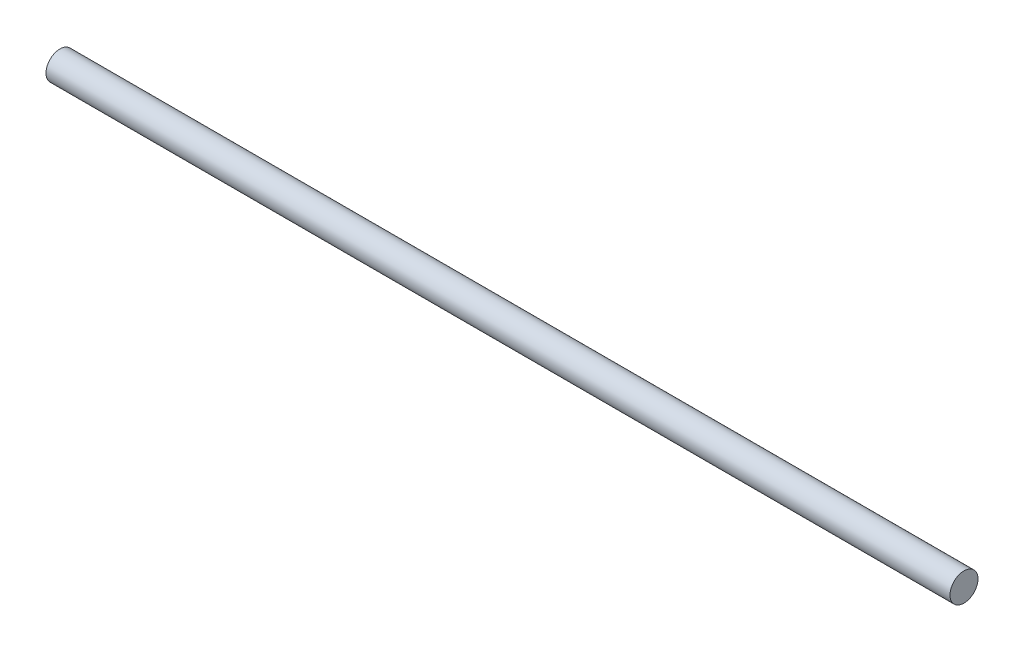
from build123d import *

# Parameters (mm, degrees)
SKETCH1_R           = 9
BOSS_EXTRUDE1_DEPTH = 290.5


with BuildPart() as part:
    # Sketch1 → Boss-Extrude1 (new, symmetric)
    with BuildSketch(Plane(origin=(0, 0, 0), x_dir=(0, 0, -1), z_dir=(1, 0, 0))):
        Circle(SKETCH1_R)
    extrude(amount=BOSS_EXTRUDE1_DEPTH, both=True)


solid = part.part
